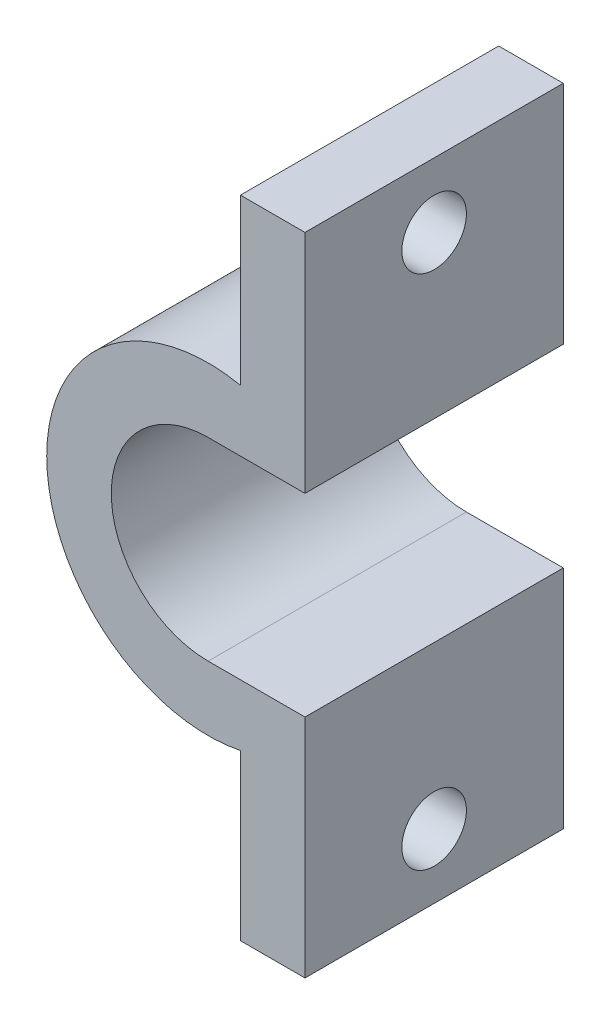
from build123d import *

# Parameters (mm, degrees)
BOSS_EXTRUDE1_DEPTH = 20
SKETCH2_R           = 2.5
CUT_EXTRUDE1_DEPTH  = 15


with BuildPart() as part:
    # Sketch1 → Boss-Extrude1 (new body)
    with BuildSketch(Plane.XY):
        with BuildLine():
            Line((-5, 12.247448714), (-5, 25))
            Line((-5, 25), (0, 25))
            Line((0, 25), (0, 7.5))
            Line((0, 7.5), (-7.5, 7.5))
            ThreePointArc((-7.5, 7.5), (-15, 0), (-7.5, -7.5))
            Line((-7.5, -7.5), (0, -7.5))
            Line((0, -7.5), (0, -25))
            Line((0, -25), (-5, -25))
            Line((-5, -25), (-5, -12.247448714))
            ThreePointArc((-5, -12.247448714), (-20, 0), (-5, 12.247448714))
        make_face()
    extrude(amount=BOSS_EXTRUDE1_DEPTH)

    # Sketch2 → Cut-Extrude1 (cut)
    with BuildSketch(Plane.ZY.offset(5)):
        with Locations(Location((10, 20, 0), (0, 0, 270))):
            Circle(SKETCH2_R)
        with Locations(Location((10, -20, 0), (0, 0, 270))):
            Circle(SKETCH2_R)
    extrude(amount=-CUT_EXTRUDE1_DEPTH, mode=Mode.SUBTRACT)


solid = part.part
